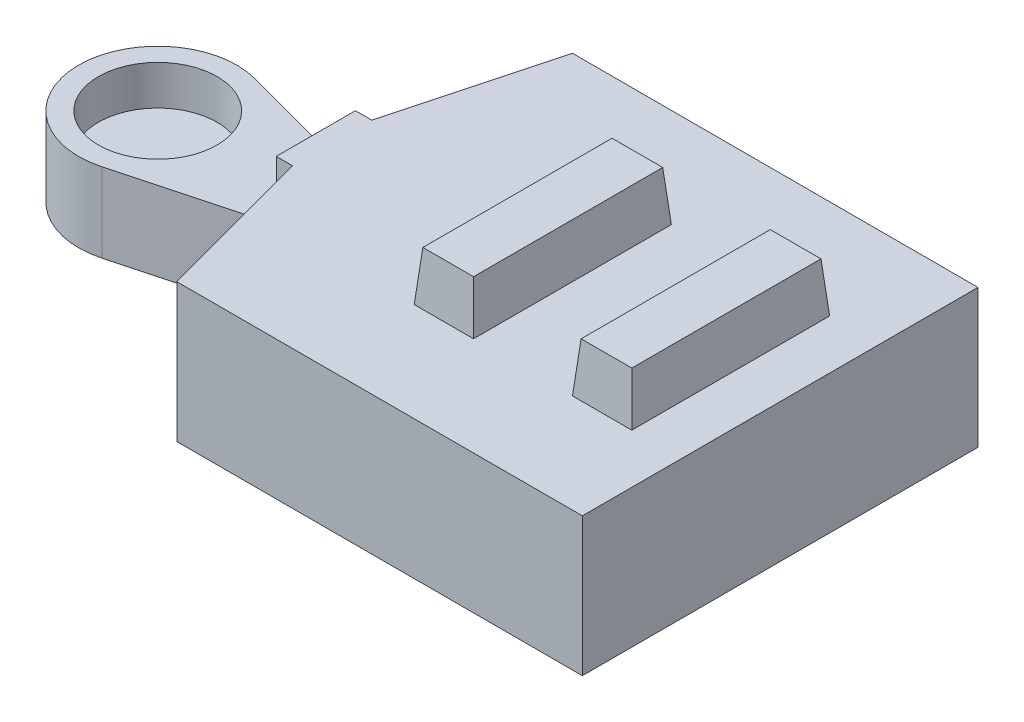
from build123d import *

# Parameters (mm, degrees)
BOSS_EXTRUDE1_DEPTH     = 4
SKETCH2_R               = 3
CUT_EXTRUDE1_DEPTH      = 2
BOSS_EXTRUDE2_DEPTH     = 3
SKETCH24_W              = 20.502400247
SKETCH24_H              = 20
BOSS_EXTRUDE4_DEPTH     = 3
SKETCH26_W              = 3
SKETCH26_H              = 10
BOSS_EXTRUDE6_DEPTH     = 2.5
CUT_EXTRUDE2_DEPTH      = 10
CUT_EXTRUDE3_DEPTH      = 35.354616727
CUT_EXTRUDE3_DEPTH_BACK = 35.354616727


with BuildPart() as part:
    # Sketch1 → Boss-Extrude1 (new body)
    with BuildSketch(Plane(origin=(0, 0, 0), x_dir=(1, 0, 0), z_dir=(0, 1, 0))):
        with BuildLine():
            Line((31.464101615, 10), (10.961701368, 10))
            Line((10.961701368, 10), (9.668549449, 5.173891336))
            Line((9.668549449, 5.173891336), (8.818107828, 2))
            Line((8.818107828, 2), (7.990711605, 2))
            Line((7.990711605, 2), (1.03527618, 3.863703305))
            ThreePointArc((1.03527618, 3.863703305), (0.522104769, 3.965779445), (0, 4))
            ThreePointArc((0, 4), (-4, 0), (0, -4))
            ThreePointArc((0, -4), (0.522104769, -3.965779445), (1.03527618, -3.863703305))
            Line((1.03527618, -3.863703305), (7.990711605, -2))
            Line((7.990711605, -2), (8.818107828, -2))
            Line((8.818107828, -2), (9.668549449, -5.173891336))
            Line((9.668549449, -5.173891336), (10.961701368, -10))
            Line((10.961701368, -10), (31.464101615, -10))
            Line((31.464101615, -10), (31.464101615, 10))
        make_face()
    extrude(amount=BOSS_EXTRUDE1_DEPTH)

    # Sketch2 → Cut-Extrude1 (cut)
    with BuildSketch(Plane(origin=(0, 4, 0), x_dir=(1, 0, 0), z_dir=(0, 1, 0))):
        with Locations(Location((0, 0, 0), (0, 0, 270))):
            Circle(SKETCH2_R)
    extrude(amount=-CUT_EXTRUDE1_DEPTH, mode=Mode.SUBTRACT)

    # Sketch18 → Boss-Extrude2 (add)
    with BuildSketch(Plane(origin=(0, 4, 0), x_dir=(1, 0, 0), z_dir=(0, 1, 0))):
        Polygon((7.990711605, -2), (8.818107828, -2), (10.961701368, -10), (10.961701368, 10), (8.818107828, 2), (7.990711605, 2), align=None)
    extrude(amount=BOSS_EXTRUDE2_DEPTH)

    # Sketch24 → Boss-Extrude4 (add)
    with BuildSketch(Plane(origin=(0, 4, 0), x_dir=(1, 0, 0), z_dir=(0, 1, 0))):
        with Locations((21.212901491, 0)):
            Rectangle(SKETCH24_W, SKETCH24_H)
    extrude(amount=BOSS_EXTRUDE4_DEPTH)

    # Sketch26 → Boss-Extrude6 (add)
    with BuildSketch(Plane(origin=(0, 7, 0), x_dir=(1, 0, 0), z_dir=(0, 1, 0))):
        with Locations((27.464101615, 0)):
            Rectangle(SKETCH26_W, SKETCH26_H)
        with Locations((19.464101615, 0)):
            Rectangle(SKETCH26_W, SKETCH26_H)
    extrude(amount=BOSS_EXTRUDE6_DEPTH)

    # Sketch27 → Cut-Extrude2 (cut)
    with BuildSketch(Plane(origin=(0, 0, -5), x_dir=(-1, 0, 0), z_dir=(0, 0, -1))):
        Polygon((-28.964101615, 7), (-28.745379956, 9.5), (-28.964101615, 9.5), align=None)
        Polygon((-25.964101615, 7), (-26.182823274, 9.5), (-25.964101615, 9.5), align=None)
        Polygon((-20.964101615, 7), (-20.745379956, 9.5), (-20.964101615, 9.5), align=None)
        Polygon((-17.964101615, 7), (-18.182823274, 9.5), (-17.964101615, 9.5), align=None)
    extrude(amount=-CUT_EXTRUDE2_DEPTH, mode=Mode.SUBTRACT)

    # Sketch28 → Cut-Extrude3 (cut, two sides: drawn at the far end of the back side and taken through both)
    with BuildSketch(Plane(origin=(0, 0, 0), x_dir=(0, 0, -1), z_dir=(1, 0, 0)).offset(-CUT_EXTRUDE3_DEPTH_BACK)):
        Polygon((-5, 7), (-4.781278341, 9.5), (-5, 9.5), align=None)
        Polygon((5, 7), (4.781278341, 9.5), (5, 9.5), align=None)
    extrude(amount=CUT_EXTRUDE3_DEPTH + CUT_EXTRUDE3_DEPTH_BACK, mode=Mode.SUBTRACT)


solid = part.part
